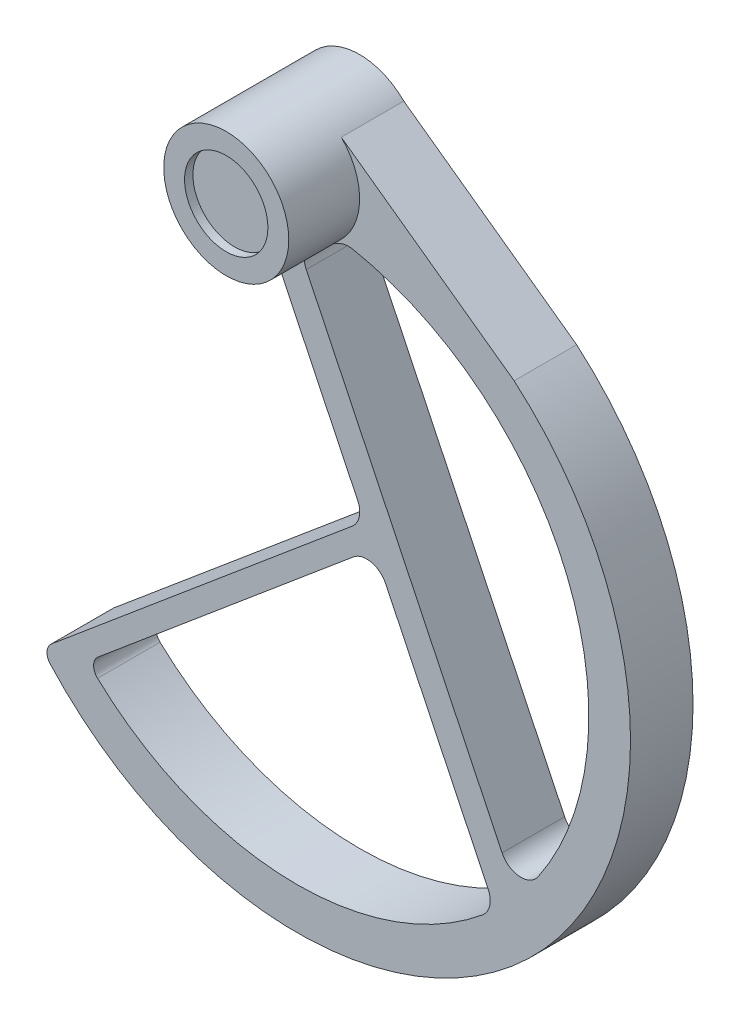
from build123d import *

# Parameters (mm, degrees)
EXTRUDE_1_DEPTH     = 15
CUT_EXTRUDE_START   = -15
CUT_EXTRUDE_1_DEPTH = 15
SKETCH_9_R          = 15
EXTRUDE_2_DEPTH     = 17
SKETCH_10_R         = 10
CUT_EXTRUDE_4_DEPTH = 2


with BuildPart() as part:
    # ｽｹｯﾁ4 → ﾎﾞｽ - 押し出し1 (new body)
    with BuildSketch(Plane.XY):
        with BuildLine():
            Line((-53.623111018, -124.995132678), (-58.940636287, -129.45706617))
            ThreePointArc((-58.940636287, -129.45706617), (-60.005384698, -131.552012131), (-59.233530865, -133.771635843))
            ThreePointArc((-59.233530865, -133.771635843), (57.362306223, -135.763481103), (52.076178918, -19.270504783))
            Line((52.076178918, -19.270504783), (10.606601718, 10.606601718))
            ThreePointArc((10.606601718, 10.606601718), (-10.606601718, 10.606601718), (-10.606601718, -10.606601718))
            Line((-10.606601718, -10.606601718), (14.536280154, -62.889638219))
            ThreePointArc((14.536280154, -62.889638219), (14.918089499, -66.109676181), (13.244185189, -68.886809092))
            Line((13.244185189, -68.886809092), (-53.623111018, -124.995132678))
        make_face()
        with BuildLine():
            Line((21.232400696, -76.813798404), (45.844843506, -127.993820346))
            ThreePointArc((45.844843506, -127.993820346), (46.221944165, -131.235480845), (44.518718993, -134.019289696))
            ThreePointArc((44.518718993, -134.019289696), (-2.231208213, -149.964431749), (-47.870174388, -131.072951785))
            ThreePointArc((-47.870174388, -131.072951785), (-48.817477846, -128.802229421), (-47.747678417, -126.586582094))
            Line((-47.747678417, -126.586582094), (13.511229465, -75.151532228))
            ThreePointArc((13.511229465, -75.151532228), (17.77869109, -74.092739753), (21.232400696, -76.813798404))
        make_face(mode=Mode.SUBTRACT)
    extrude(amount=EXTRUDE_1_DEPTH)

    # ｽｹｯﾁ6 → ｶｯﾄ - 押し出し1 (cut)
    with BuildSketch(Plane.XY.offset(15).offset(CUT_EXTRUDE_START)):
        with BuildLine():
            Line((49.189589797, -118.797265215), (2.201751786, -21.089020696))
            ThreePointArc((2.201751786, -21.089020696), (1.989274209, -17.268089629), (4.540836142, -14.416039025))
            Line((4.540836142, -14.416039025), (6.483415605, -13.48185369))
            Line((6.483415605, -13.48185369), (10.219658847, -11.685096486))
            ThreePointArc((10.219658847, -11.685096486), (11.747077013, -11.232198087), (13.339423466, -11.282754846))
            ThreePointArc((13.339423466, -11.282754846), (64.738421392, -53.37413296), (57.826055334, -119.448033215))
            ThreePointArc((57.826055334, -119.448033215), (53.319931874, -121.616182211), (49.189589797, -118.797265215))
        make_face()
    extrude(amount=CUT_EXTRUDE_1_DEPTH, mode=Mode.SUBTRACT)

    # ｽｹｯﾁ9 → ﾎﾞｽ - 押し出し2 (add)
    with BuildSketch(Plane.XY.offset(15)):
        with Locations(Location((0, 0, 0), (0, 0, 225))):
            Circle(SKETCH_9_R)
    extrude(amount=EXTRUDE_2_DEPTH)

    # ｽｹｯﾁ10 → ｶｯﾄ - 押し出し4 (cut)
    with BuildSketch(Plane.XY.offset(32)):
        Circle(SKETCH_10_R)
    extrude(amount=-CUT_EXTRUDE_4_DEPTH, mode=Mode.SUBTRACT)


solid = part.part
